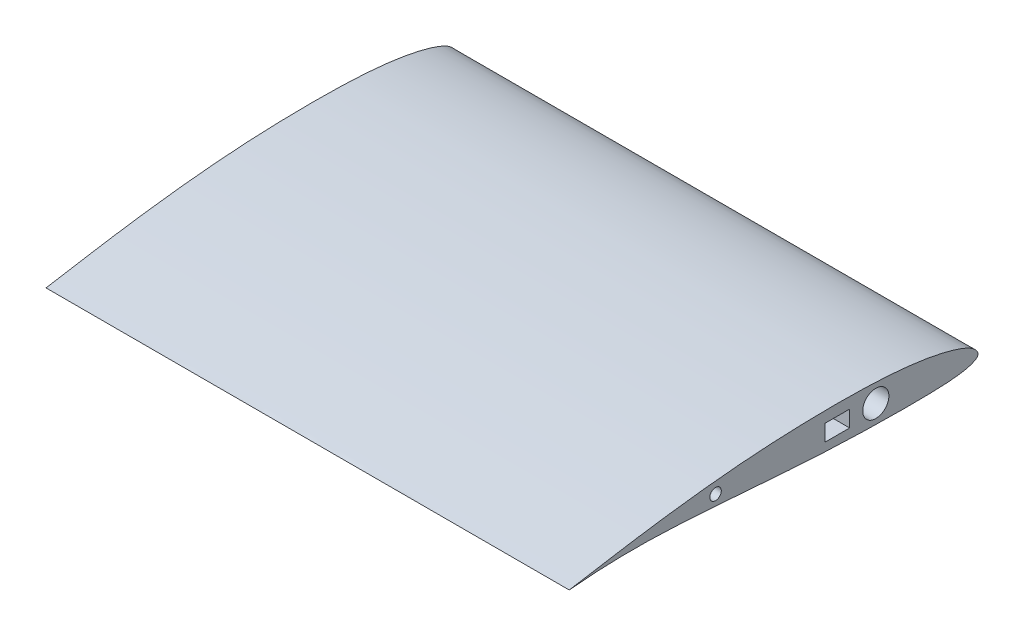
from build123d import *

# Parameters (mm, degrees)
SCHIZZO1_R                = 8
SCHIZZO1_W                = 15
SCHIZZO1_H                = 10
CORPOFOAM_DEPTH           = 320
SCHIZZO2_R                = 3.5
FOROCENTINASINISTRA_DEPTH = 15
FOROCENTIANDESTRA_START   = -15
SCHIZZO3_R                = 3.5
FOROCENTIANDESTRA_DEPTH   = 15


with BuildPart() as part:
    # Schizzo1 → CorpoFoam (new body)
    with BuildSketch(Plane(origin=(0, 0, 0), x_dir=(0, 0, -1), z_dir=(1, 0, 0))):
        with BuildLine():
            add(Edge.make_bspline(
                [(-250, 0), (-250.000228294, -0.008042796), (-248.284955516, 0.172375658), (-246.518112419, 0.308690015), (-242.189387343, 0.685693594), (-236.806461263, 1.074101529), (-229.680385952, 1.49731724), (-221.184158698, 1.823218603), (-211.337618208, 1.967626101), (-200.371188527, 1.833221056), (-188.499913622, 1.38960529), (-175.953687417, 0.706014078), (-162.931424918, -0.160208642), (-149.615771744, -1.148016327), (-136.176354995, -2.19092491), (-122.767140548, -3.219583979), (-109.520053587, -4.152743127), (-96.546095975, -4.938564365), (-83.940819302, -5.536830703), (-71.801839291, -5.947648205), (-60.245256003, -6.218450939), (-49.398732891, -6.355369756), (-39.397226194, -6.381387963), (-30.361934842, -6.26504923), (-22.412181103, -6.012164917), (-15.626227231, -5.597433901), (-10.071907511, -4.928706579), (-5.697692612, -4.040446981), (-2.625320639, -2.865752984), (-0.494884225, -1.71152847), (0.021312549, -0.410454231), (-0.0311692, 0.792659827), (-0.812599242, 2.305684337), (-2.728863517, 4.238352424), (-5.769907241, 6.118172121), (-9.880942804, 7.913594202), (-15.074930468, 9.641318178), (-21.298752222, 11.283896488), (-28.49717212, 12.788381759), (-36.607373406, 14.097834908), (-45.57302844, 15.159429017), (-55.332910074, 15.960903998), (-65.816536498, 16.494069738), (-76.93137626, 16.791989705), (-88.566949028, 16.864754131), (-100.596999886, 16.726715291), (-112.888825982, 16.383385064), (-125.311615819, 15.825573667), (-137.743791097, 15.05233187), (-150.072384382, 14.059339074), (-162.191375056, 12.881586986), (-173.989074322, 11.549280346), (-185.352364446, 10.116249729), (-196.163081698, 8.632379125), (-206.300441402, 7.131513884), (-215.560350587, 5.731221768), (-223.977157043, 4.293295127), (-231.363413336, 3.181808874), (-237.746440904, 2.098942417), (-242.622069366, 1.245861917), (-246.644529332, 0.552864946), (-248.32839844, 0.246216765), (-249.999773563, 0.007977377), (-250, 0)],
                knots=[0, 0, 0, 0, 0.001588889, 0.006329218, 0.014202456, 0.025172808, 0.039173483, 0.056060631, 0.075578924, 0.097363607, 0.120926258, 0.145825281, 0.171670912, 0.198108537, 0.224790184, 0.25139058, 0.277643491, 0.30332675, 0.328257458, 0.352272548, 0.375156062, 0.396620664, 0.416422729, 0.43430442, 0.45005468, 0.463465465, 0.474478994, 0.483169222, 0.489678354, 0.494104066, 0.496910015, 0.497289785, 0.501214273, 0.50645795, 0.513356957, 0.522168632, 0.53296597, 0.545689209, 0.560220779, 0.576438923, 0.594258689, 0.613600245, 0.634342386, 0.656331109, 0.679351894, 0.703152303, 0.727478208, 0.752070739, 0.776691164, 0.801140184, 0.825214387, 0.848697424, 0.871352858, 0.892947449, 0.913230871, 0.931955467, 0.948342069, 0.963693004, 0.976235918, 0.986320059, 0.993788799, 0.998424035, 1, 1, 1, 1], degree=3))
        make_face()
        with Locations((-62.499919709, 5.077322704)):
            Circle(SCHIZZO1_R, mode=Mode.SUBTRACT)
        with Locations((-85.999919709, 5.077322704)):
            Rectangle(SCHIZZO1_W, SCHIZZO1_H, mode=Mode.SUBTRACT)
    extrude(amount=CORPOFOAM_DEPTH)

    # Schizzo2 → ForoCentinaSinistra (cut)
    with BuildSketch(Plane.ZY):
        with Locations((160.499919709, 6.077322704)):
            Circle(SCHIZZO2_R)
    extrude(amount=-FOROCENTINASINISTRA_DEPTH, mode=Mode.SUBTRACT)

    # Schizzo3 → ForoCentianDestra (cut)
    with BuildSketch(Plane(origin=(320, 0, 0), x_dir=(0, 0, -1), z_dir=(1, 0, 0)).offset(FOROCENTIANDESTRA_START)):
        with Locations(Location((-160.499919709, 6.077322704, 0), (0, 0, 180))):
            Circle(SCHIZZO3_R)
    extrude(amount=FOROCENTIANDESTRA_DEPTH, mode=Mode.SUBTRACT)


solid = part.part
